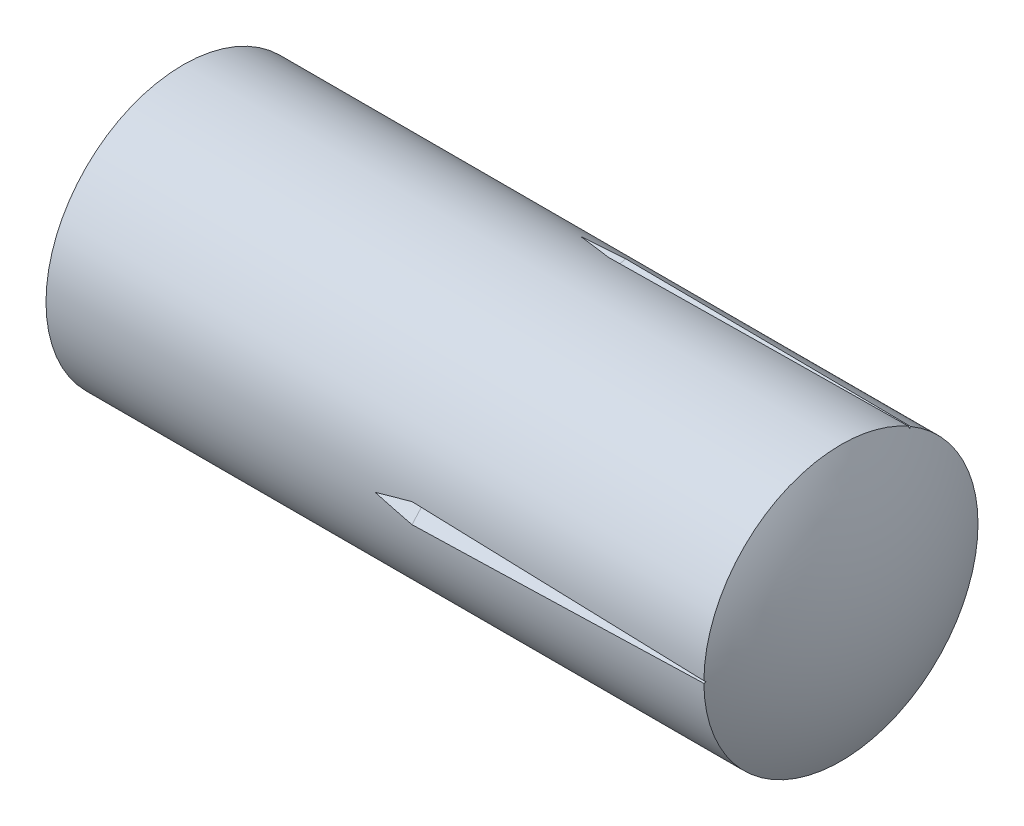
from build123d import *

# Parameters (mm, degrees)
CIRPATTERN1_COUNT = 3


with BuildPart() as part:
    # Sketch1 → Base-Revolve (revolve)
    with BuildSketch(Plane.XY):
        with BuildLine():
            Line((-4, 0), (-4, 0.15))
            ThreePointArc((-4, 0.15), (-3.881206061, 0.848681403), (-3.601828558, 1.5))
            Line((-3.601828558, 1.5), (3.598076211, 1.5))
            ThreePointArc((3.598076211, 1.5), (3.897777479, 0.776457135), (4, 0))
            Line((4, 0), (-4, 0))
        make_face()
    revolve(axis=Axis((-57, 0, 0), (1, 0, 0)))

    # Cut-Sweep1: sweep along a path in Sketch3
    with BuildLine(Plane(origin=(0, 0, 0), x_dir=(1, 0, 0), z_dir=(0, 1, 0))) as cut_sweep1_path:
        Line((0, -1.5), (0.375, -1.35))
        Line((0.375, -1.35), (4, -1.5))
    # Sketch2 → Cut-Sweep1 (sweep, cut)
    with BuildSketch(Plane(origin=(0, 0, 0), x_dir=(0, 0, -1), z_dir=(1, 0, 0))):
        Polygon((-1.5, 0), (-3.378358908, 1.315241067), (-3.378358908, -1.315241067), align=None)
    cut_sweep1 = sweep(path=cut_sweep1_path.line, transition=Transition.RIGHT, mode=Mode.SUBTRACT)

    # CirPattern1: Cut-Sweep1 ×3 about axis
    cirpattern1_axis = Axis((0, 0, 0), (1, 0, 0))
    for i in range(1, CIRPATTERN1_COUNT):
        add(cut_sweep1.rotate(cirpattern1_axis, i * 360 / CIRPATTERN1_COUNT), mode=Mode.SUBTRACT)


solid = part.part
